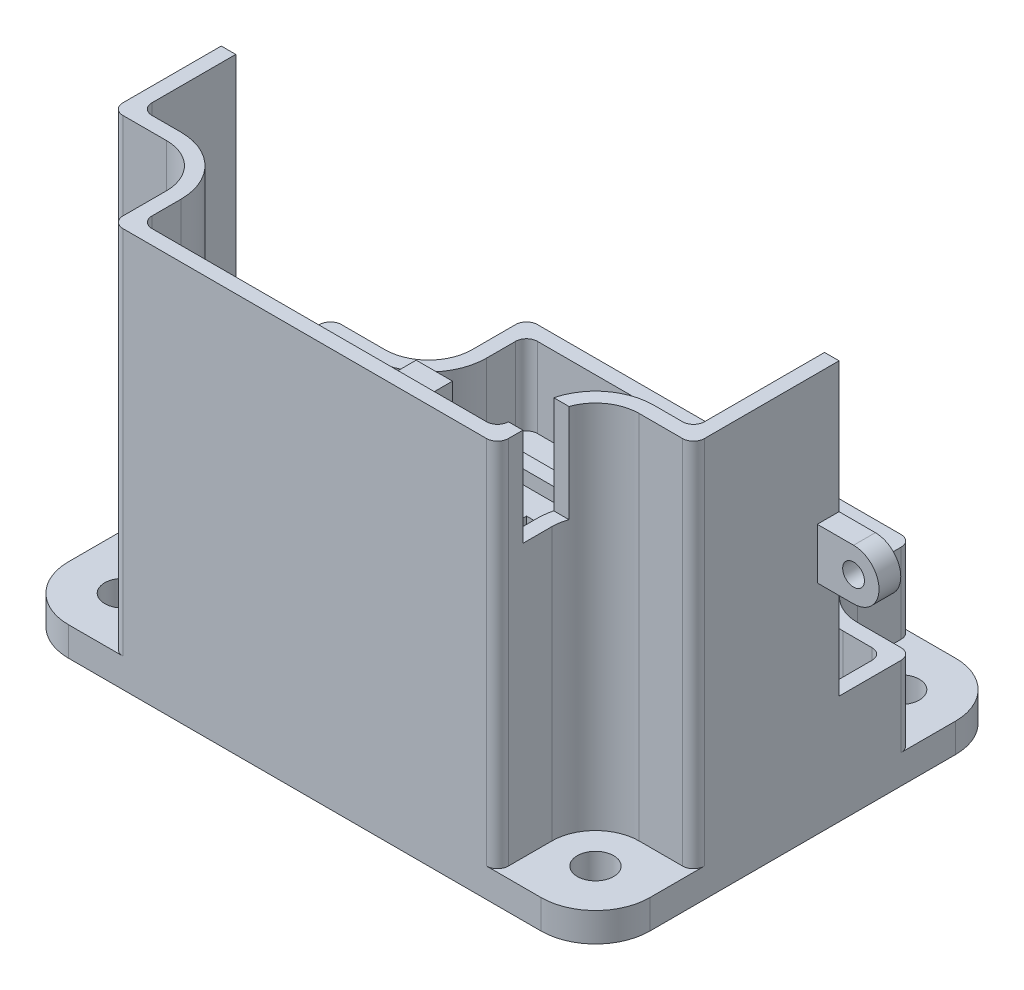
from build123d import *

# Parameters (mm, degrees)
EXTRUDE_1_DEPTH     = 4
SKETCH_1_3_R        = 2.5
CUT_EXTRUDE_1_DEPTH = 5
SKETCH_1_4_W        = 52.5
SKETCH_1_4_H        = 21.3
EXTRUDE_2_DEPTH     = 12.2
EXTRUDE_5_DEPTH     = 15
SKETCH_1_8_W        = 2
SKETCH_1_8_H        = 5
EXTRUDE_7_DEPTH     = 55
EXTRUDE_8_DEPTH     = 41
CUT_EXTRUDE_START   = -51.1
SKETCH_4_W          = 6
SKETCH_4_H          = 13.5
CUT_EXTRUDE_2_DEPTH = 2.5
SKETCH_7_W          = 37.5
SKETCH_7_H          = 3.5
CUT_EXTRUDE_3_DEPTH = 37
SKETCH_1_12_W       = 3
SKETCH_1_12_H       = 6.5
EXTRUDE_10_DEPTH    = 41
SKETCH_7_4_W        = 5
SKETCH_7_4_H        = 1.5
EXTRUDE_12_DEPTH    = 6
SKETCH_1_13_W       = 3
SKETCH_1_13_H       = 6.5
EXTRUDE_13_DEPTH    = 47
EXTRUDE_START       = 6
SKETCH_7_5_W        = 5
SKETCH_7_5_H        = 1.5
EXTRUDE_14_DEPTH    = 43
EXTRUDE_START_2     = -28.55
SKETCH_8_R          = 1.5
EXTRUDE_15_DEPTH    = 3
EXTRUDE_START_3     = -33.55
SKETCH_8_3_R        = 1.5
EXTRUDE_16_DEPTH    = 3


with BuildPart() as part:
    # Эскиз1 → Бобышка-Вытянуть1 (new body)
    with BuildSketch(Plane(origin=(0, 0, 0), x_dir=(1, 0, 0), z_dir=(0, 1, 0))):
        with BuildLine():
            Line((-65.1, 49.6), (0, 49.6))
            ThreePointArc((0, 49.6), (5.303300859, 47.403300859), (7.5, 42.1))
            Line((7.5, 42.1), (7.5, 0))
            ThreePointArc((7.5, 0), (5.303300859, -5.303300859), (0, -7.5))
            Line((0, -7.5), (-65.1, -7.5))
            ThreePointArc((-65.1, -7.5), (-70.403300859, -5.303300859), (-72.6, 0))
            Line((-72.6, 0), (-72.6, 42.1))
            ThreePointArc((-72.6, 42.1), (-70.403300859, 47.403300859), (-65.1, 49.6))
        make_face()
    extrude(amount=EXTRUDE_1_DEPTH)

    # Эскиз1<3> → Вырез-Вытянуть1 (cut)
    with BuildSketch(Plane(origin=(0, 0, 0), x_dir=(1, 0, 0), z_dir=(0, 1, 0))):
        with Locations(Location((-65.1, 42.1, 0), (0, 0, 270))):
            Circle(SKETCH_1_3_R)
        with Locations(Location((0, 42.1, 0), (0, 0, 90))):
            Circle(SKETCH_1_3_R)
        with Locations(Location((0, 0, 0), (0, 0, 270))):
            Circle(SKETCH_1_3_R)
        with Locations(Location((-65.1, 0, 0), (0, 0, 90))):
            Circle(SKETCH_1_3_R)
    extrude(amount=CUT_EXTRUDE_1_DEPTH, mode=Mode.SUBTRACT)

    # Эскиз1<4> → Бобышка-Вытянуть2 (add)
    with BuildSketch(Plane(origin=(0, 0, 0), x_dir=(1, 0, 0), z_dir=(0, 1, 0))):
        with BuildLine():
            ThreePointArc((-59.697222936, 36.2), (-60.230200598, 35.752949206), (-60.8, 35.35389001))
            Line((-60.8, 35.35389001), (-60.8, 10.9))
            Line((-60.8, 10.9), (-4.3, 10.9))
            Line((-4.3, 10.9), (-4.3, 35.35389001))
            ThreePointArc((-4.3, 35.35389001), (-4.869799402, 35.752949206), (-5.402777064, 36.2))
            Line((-5.402777064, 36.2), (-59.697222936, 36.2))
        make_face()
        with Locations((-32.55, 23.55)):
            Rectangle(SKETCH_1_4_W, SKETCH_1_4_H, mode=Mode.SUBTRACT)
    extrude(amount=EXTRUDE_2_DEPTH)

    # Эскиз1<7> → Бобышка-Вытянуть5 (add)
    with BuildSketch(Plane(origin=(0, 0, 0), x_dir=(1, 0, 0), z_dir=(0, 1, 0))):
        with BuildLine():
            Line((-7.5, 49.6), (-57.6, 49.6))
            ThreePointArc((-57.6, 49.6), (-58.660660172, 49.160660172), (-59.1, 48.1))
            Line((-59.1, 48.1), (-59.1, 42.1))
            ThreePointArc((-59.1, 42.1), (-60.857359313, 37.857359313), (-65.1, 36.1))
            Line((-65.1, 36.1), (-71.1, 36.1))
            ThreePointArc((-71.1, 36.1), (-72.160660172, 35.660660172), (-72.6, 34.6))
            Line((-72.6, 34.6), (-72.6, 7.5))
            ThreePointArc((-72.6, 7.5), (-72.160660172, 6.439339828), (-71.1, 6))
            Line((-71.1, 6), (-65.1, 6))
            ThreePointArc((-65.1, 6), (-60.857359313, 4.242640687), (-59.1, 0))
            Line((-59.1, 0), (-59.1, -6))
            ThreePointArc((-59.1, -6), (-58.660660172, -7.060660172), (-57.6, -7.5))
            Line((-57.6, -7.5), (-7.5, -7.5))
            ThreePointArc((-7.5, -7.5), (-6.439339828, -7.060660172), (-6, -6))
            Line((-6, -6), (-6, 0))
            ThreePointArc((-6, 0), (-4.242640687, 4.242640687), (0, 6))
            Line((0, 6), (6, 6))
            ThreePointArc((6, 6), (7.060660172, 6.439339828), (7.5, 7.5))
            Line((7.5, 7.5), (7.5, 21.05))
            Line((7.5, 21.05), (5.5, 21.05))
            Line((5.5, 21.05), (5.5, 9.5))
            ThreePointArc((5.5, 9.5), (5.060660172, 8.439339828), (4, 8))
            Line((4, 8), (0, 8))
            ThreePointArc((0, 8), (-5.656854249, 5.656854249), (-8, 0))
            Line((-8, 0), (-8, -4))
            ThreePointArc((-8, -4), (-8.439339828, -5.060660172), (-9.5, -5.5))
            Line((-9.5, -5.5), (-55.6, -5.5))
            ThreePointArc((-55.6, -5.5), (-56.660660172, -5.060660172), (-57.1, -4))
            Line((-57.1, -4), (-57.1, 0))
            ThreePointArc((-57.1, 0), (-59.443145751, 5.656854249), (-65.1, 8))
            Line((-65.1, 8), (-69.1, 8))
            ThreePointArc((-69.1, 8), (-70.160660172, 8.439339828), (-70.6, 9.5))
            Line((-70.6, 9.5), (-70.6, 32.6))
            ThreePointArc((-70.6, 32.6), (-70.160660172, 33.660660172), (-69.1, 34.1))
            Line((-69.1, 34.1), (-65.1, 34.1))
            ThreePointArc((-65.1, 34.1), (-59.443145751, 36.443145751), (-57.1, 42.1))
            Line((-57.1, 42.1), (-57.1, 46.1))
            ThreePointArc((-57.1, 46.1), (-56.660660172, 47.160660172), (-55.6, 47.6))
            Line((-55.6, 47.6), (-9.5, 47.6))
            ThreePointArc((-9.5, 47.6), (-8.439339828, 47.160660172), (-8, 46.1))
            Line((-8, 46.1), (-8, 42.1))
            ThreePointArc((-8, 42.1), (-5.656854249, 36.443145751), (0, 34.1))
            Line((0, 34.1), (4, 34.1))
            ThreePointArc((4, 34.1), (5.060660172, 33.660660172), (5.5, 32.6))
            Line((5.5, 32.6), (5.5, 26.05))
            Line((5.5, 26.05), (7.5, 26.05))
            Line((7.5, 26.05), (7.5, 34.6))
            ThreePointArc((7.5, 34.6), (7.060660172, 35.660660172), (6, 36.1))
            Line((6, 36.1), (0, 36.1))
            ThreePointArc((0, 36.1), (-4.242640687, 37.857359313), (-6, 42.1))
            Line((-6, 42.1), (-6, 48.1))
            ThreePointArc((-6, 48.1), (-6.439339828, 49.160660172), (-7.5, 49.6))
        make_face()
    extrude(amount=EXTRUDE_5_DEPTH)

    # Эскиз1<8> → Бобышка-Вытянуть7 (add)
    with BuildSketch(Plane(origin=(0, 0, 0), x_dir=(1, 0, 0), z_dir=(0, 1, 0))):
        with BuildLine():
            Line((-70.6, 21.05), (-72.6, 21.05))
            Line((-72.6, 21.05), (-72.6, 7.5))
            ThreePointArc((-72.6, 7.5), (-72.160660172, 6.439339828), (-71.1, 6))
            Line((-71.1, 6), (-65.1, 6))
            ThreePointArc((-65.1, 6), (-60.857359313, 4.242640687), (-59.1, 0))
            Line((-59.1, 0), (-59.1, -6))
            ThreePointArc((-59.1, -6), (-58.660660172, -7.060660172), (-57.6, -7.5))
            Line((-57.6, -7.5), (-7.5, -7.5))
            ThreePointArc((-7.5, -7.5), (-6.439339828, -7.060660172), (-6, -6))
            Line((-6, -6), (-6, 0))
            ThreePointArc((-6, 0), (-4.242640687, 4.242640687), (0, 6))
            Line((0, 6), (6, 6))
            ThreePointArc((6, 6), (7.060660172, 6.439339828), (7.5, 7.5))
            Line((7.5, 7.5), (7.5, 21.05))
            Line((7.5, 21.05), (5.5, 21.05))
            Line((5.5, 21.05), (5.5, 9.5))
            ThreePointArc((5.5, 9.5), (5.060660172, 8.439339828), (4, 8))
            Line((4, 8), (0, 8))
            ThreePointArc((0, 8), (-4.242640687, 6.782329983), (-7.193747285, 3.5))
            ThreePointArc((-7.193747285, 3.5), (-7.795831523, 1.795831523), (-8, 0))
            Line((-8, 0), (-8, -4))
            ThreePointArc((-8, -4), (-8.439339828, -5.060660172), (-9.5, -5.5))
            Line((-9.5, -5.5), (-15.1, -5.5))
            Line((-15.1, -5.5), (-18.1, -5.5))
            Line((-18.1, -5.5), (-47, -5.5))
            Line((-47, -5.5), (-50, -5.5))
            Line((-50, -5.5), (-55.6, -5.5))
            ThreePointArc((-55.6, -5.5), (-56.660660172, -5.060660172), (-57.1, -4))
            Line((-57.1, -4), (-57.1, 0))
            ThreePointArc((-57.1, 0), (-57.304168477, 1.795831523), (-57.906252715, 3.5))
            ThreePointArc((-57.906252715, 3.5), (-60.857359313, 6.782329983), (-65.1, 8))
            Line((-65.1, 8), (-69.1, 8))
            ThreePointArc((-69.1, 8), (-70.160660172, 8.439339828), (-70.6, 9.5))
            Line((-70.6, 9.5), (-70.6, 21.05))
        make_face()
        with Locations((6.5, 23.55)):
            Rectangle(SKETCH_1_8_W, SKETCH_1_8_H)
    extrude(amount=EXTRUDE_7_DEPTH)

    # Эскиз1<9> → Бобышка-Вытянуть8 (add)
    with BuildSketch(Plane(origin=(0, 0, 0), x_dir=(1, 0, 0), z_dir=(0, 1, 0))):
        with BuildLine():
            Line((-50, 3.5), (-50, 1))
            Line((-50, 1), (-47, 1))
            Line((-47, 1), (-47, -5.5))
            Line((-47, -5.5), (-18.1, -5.5))
            Line((-18.1, -5.5), (-18.1, 1))
            Line((-18.1, 1), (-15.1, 1))
            Line((-15.1, 1), (-15.1, -5.5))
            Line((-15.1, -5.5), (-9.5, -5.5))
            Line((-9.5, -5.5), (-9.5, 0))
            Line((-9.5, 0), (-8, 0))
            ThreePointArc((-8, 0), (-7.795831523, 1.795831523), (-7.193747285, 3.5))
            Line((-7.193747285, 3.5), (-50, 3.5))
        make_face()
    extrude(amount=EXTRUDE_8_DEPTH)

    # Эскиз4 → Вырез-Вытянуть2 (cut, symmetric)
    with BuildSketch(Plane.ZY.offset(59.1).offset(CUT_EXTRUDE_START)):
        with Locations((1, 48.25)):
            Rectangle(SKETCH_4_W, SKETCH_4_H)
    extrude(amount=CUT_EXTRUDE_2_DEPTH, both=True, mode=Mode.SUBTRACT)

    # Эскиз7 → Вырез-Вытянуть3 (cut)
    with BuildSketch(Plane(origin=(0, 41, 0), x_dir=(1, 0, 0), z_dir=(0, 1, 0))):
        with Locations((-28.25, -3.75)):
            Rectangle(SKETCH_7_W, SKETCH_7_H)
    extrude(amount=-CUT_EXTRUDE_3_DEPTH, mode=Mode.SUBTRACT)

    # Эскиз1<12> → Бобышка-Вытянуть10 (add)
    with BuildSketch(Plane(origin=(0, 0, 0), x_dir=(1, 0, 0), z_dir=(0, 1, 0))):
        with Locations((-16.6, -2.25)):
            Rectangle(SKETCH_1_12_W, SKETCH_1_12_H)
    extrude(amount=EXTRUDE_10_DEPTH)

    # Эскиз7<4> → Бобышка-Вытянуть12 (add)
    with BuildSketch(Plane(origin=(0, 41, 0), x_dir=(1, 0, 0), z_dir=(0, 1, 0))):
        with Locations((-27.2, 2.75)):
            Rectangle(SKETCH_7_4_W, SKETCH_7_4_H)
    extrude(amount=EXTRUDE_12_DEPTH)

    # Эскиз1<13> → Бобышка-Вытянуть13 (add)
    with BuildSketch(Plane(origin=(0, 0, 0), x_dir=(1, 0, 0), z_dir=(0, 1, 0))):
        with Locations((-48.5, -2.25)):
            Rectangle(SKETCH_1_13_W, SKETCH_1_13_H)
    extrude(amount=EXTRUDE_13_DEPTH)

    # Эскиз7<5> → Бобышка-Вытянуть14 (add)
    with BuildSketch(Plane(origin=(0, 41, 0), x_dir=(1, 0, 0), z_dir=(0, 1, 0)).offset(EXTRUDE_START)):
        with Locations((-27.2, 4.25)):
            Rectangle(SKETCH_7_5_W, SKETCH_7_5_H)
    extrude(amount=-EXTRUDE_14_DEPTH)

    # Эскиз8 → Бобышка-Вытянуть15 (add)
    with BuildSketch(Plane.XY.offset(7.5).offset(EXTRUDE_START_2)):
        with BuildLine():
            Line((-72.6, 37), (-77.6, 37))
            ThreePointArc((-77.6, 37), (-81.1, 33.5), (-77.6, 30))
            Line((-77.6, 30), (-72.6, 30))
            Line((-72.6, 30), (-72.6, 37))
        make_face()
        with Locations(Location((-77.6, 33.5, 0), (0, 0, 180))):
            Circle(SKETCH_8_R, mode=Mode.SUBTRACT)
    extrude(amount=EXTRUDE_15_DEPTH)

    # Эскиз8<3> → Бобышка-Вытянуть16 (add)
    with BuildSketch(Plane.XY.offset(7.5).offset(EXTRUDE_START_3)):
        with BuildLine():
            ThreePointArc((12.5, 37), (16, 33.5), (12.5, 30))
            Line((12.5, 30), (7.5, 30))
            Line((7.5, 30), (7.5, 37))
            Line((7.5, 37), (12.5, 37))
        make_face()
        with Locations((12.5, 33.5)):
            Circle(SKETCH_8_3_R, mode=Mode.SUBTRACT)
    extrude(amount=EXTRUDE_16_DEPTH)


solid = part.part
